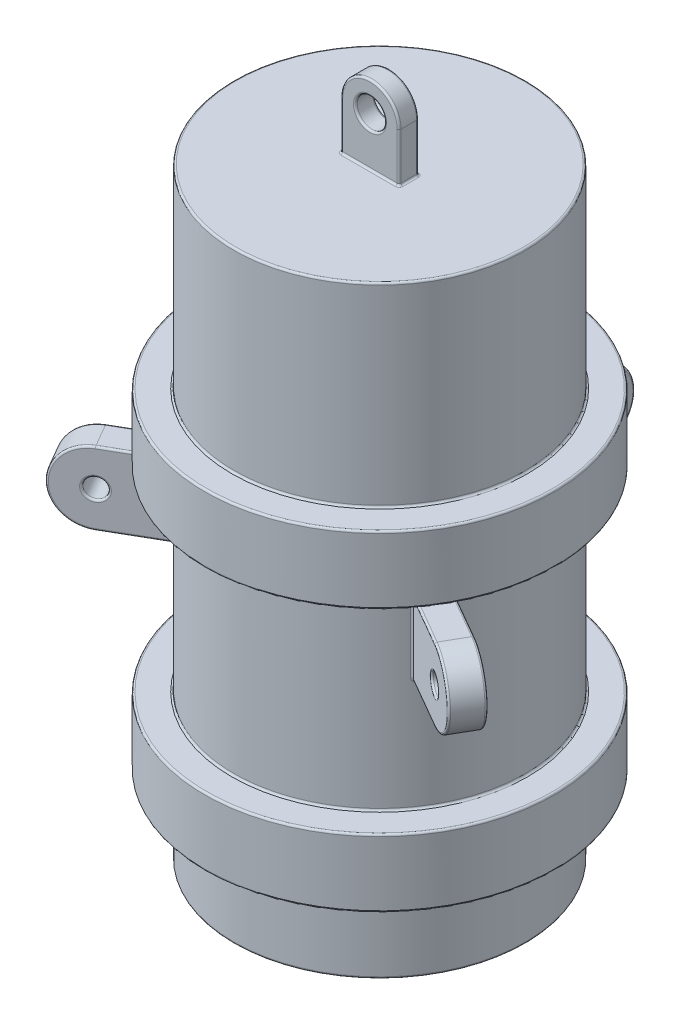
from build123d import *

# Parameters (mm, degrees)
CROQUIS2_R              = 1.5
SALIENTE_EXTRUIR1_DEPTH = 1
CROQUIS3_R              = 1
SALIENTE_EXTRUIR2_DEPTH = 1.5
MATRIZC1_COUNT          = 3
REDONDEO1_R             = 0.2


with BuildPart() as part:
    # Croquis1 → Revolución1 (revolve)
    with BuildSketch(Plane.XY, mode=Mode.PRIVATE) as revoluci_n1_sk:
        Polygon((-4, 0), (-15, 0), (-15, 8), (-18, 8), (-18, 15), (-15, 15), (-15, 35), (-18, 35), (-18, 42), (-15, 42), (-15, 62), (0, 62), (0, 61), (-14, 61), (-14, 41), (-17, 41), (-17, 36), (-14, 36), (-14, 14), (-17, 14), (-17, 9), (-14, 9), (-14, 1), (-4, 1), align=None)
    revolve(revoluci_n1_sk.sketch.rotate(Axis((0, 0, 0), (0, 1, 0)), 270), axis=Axis((0, 0, 0), (0, 1, 0)))

    # Croquis2 → Saliente-Extruir1 (add, symmetric)
    with BuildSketch(Plane.XY):
        with BuildLine():
            Line((-3, 62), (3, 62))
            Line((3, 62), (3, 67))
            ThreePointArc((3, 67), (0, 70), (-3, 67))
            Line((-3, 67), (-3, 62))
        make_face()
        with Locations((0, 67)):
            Circle(CROQUIS2_R, mode=Mode.SUBTRACT)
    extrude(amount=SALIENTE_EXTRUIR1_DEPTH, both=True)

    # Croquis3 → Saliente-Extruir2 (add, symmetric)
    with BuildSketch(Plane(origin=(0, 0, 0), x_dir=(0, 0, -1), z_dir=(1, 0, 0))):
        with BuildLine():
            Line((14, 34), (21, 34))
            ThreePointArc((21, 34), (24.75, 30.25), (21, 26.5))
            Line((21, 26.5), (14, 26.5))
            Line((14, 26.5), (14, 34))
        make_face()
        with Locations((21, 30.25)):
            Circle(CROQUIS3_R, mode=Mode.SUBTRACT)
    saliente_extruir2 = extrude(amount=SALIENTE_EXTRUIR2_DEPTH, both=True)

    # MatrizC1: Saliente-Extruir2 ×3 about axis
    matrizc1_axis = Axis((0, 0, 0), (0, 1, 0))
    for i in range(1, MATRIZC1_COUNT):
        add(saliente_extruir2.rotate(matrizc1_axis, i * 360 / MATRIZC1_COUNT))

    # Redondeo1
    redondeo1_edges = [part.edges().sort_by_distance(p)[0] for p in [
        (-12.990381057, 26.5, 7.5),
        (-14.805899717, 26.5, 10.280240995),
        (-14.805899717, 34, 10.280240995),
        (-12.990381057, 34, 7.5),
        (-20.684128744, 30.25, 13.674038106),
        (-18.070508076, 30.25, 8.700961894),
        (13.675265955, 30.25, 6.163367673),
        (12.175265955, 30.25, 8.761443884),
        (14.805899717, 34, 10.280240995),
        (14.805899717, 26.5, 10.280240995),
        (20.684128744, 30.25, 13.674038106),
        (18.070508076, 30.25, 8.700961894),
        (12.990381057, 26.5, 7.5),
        (16.305899717, 26.5, 7.682164783),
        (16.305899717, 34, 7.682164783),
        (12.990381057, 34, 7.5),
        (22.184128744, 30.25, 11.075961894),
        (16.570508076, 30.25, 11.299038106),
        (0, 61, 14),
        (0, 41, 14),
        (0, 41, 17),
        (0, 36, 17),
        (0, 36, 14),
        (0, 14, 14),
        (0, 14, 17),
        (0, 9, 17),
        (0, 9, 14),
        (0, 1, 14),
        (0, 1, 4),
        (0, 0, 4),
        (0, 0, 15),
        (0, 8, 15),
        (0, 8, 18),
        (0, 15, 18),
        (0, 15, 15),
        (0, 35, 15),
        (0, 35, 18),
        (0, 42, 18),
        (0, 42, 15),
        (0, 62, 15),
        (-3, 64.5, 1),
        (0, 62, 1),
        (3, 64.5, 1),
        (0, 70, 1),
        (-1.5, 67, -1),
        (-3, 64.5, -1),
        (0, 62, -1),
        (-3, 62, 0),
        (3, 64.5, -1),
        (3, 62, 0),
        (0, 70, -1),
        (-1.5, 67, 1),
        (-1.5, 30.25, -14.924811557),
        (1.5, 30.25, -14.924811557),
        (1.5, 34, -17.962405778),
        (1.5, 26.5, -17.962405778),
        (1.5, 30.25, -24.75),
        (-1.5, 30.25, -20),
        (-0.750941626, 26.5, -14.981191097),
        (-1.5, 26.5, -17.962405778),
        (-1.5, 34, -17.962405778),
        (-0.750941626, 34, -14.981191097),
        (-1.5, 30.25, -24.75),
        (1.5, 30.25, -20),
        (-12.175265955, 30.25, 8.761443884),
        (-13.675265955, 30.25, 6.163367673),
        (-16.305899717, 34, 7.682164783),
        (-16.305899717, 26.5, 7.682164783),
        (-22.184128744, 30.25, 11.075961894),
        (-16.570508076, 30.25, 11.299038106),
    ]]
    fillet(redondeo1_edges, radius=REDONDEO1_R)


solid = part.part
